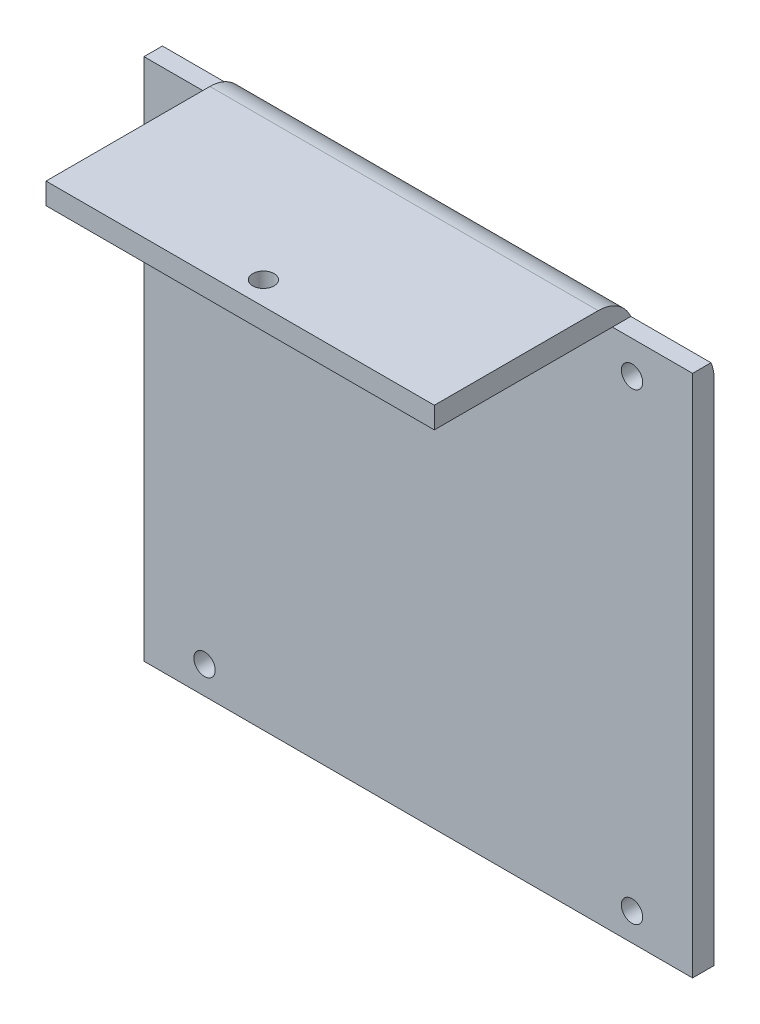
from build123d import *

# Parameters (mm, degrees)
ESQUISSE1_W             = 77
ESQUISSE1_H             = 73.5
ESQUISSE1_R             = 1.5
BOSS_EXTRU_1_DEPTH      = 3
ESQUISSE45_W            = 54.5
ESQUISSE45_H            = 3
BOSS_EXTRU_2_DEPTH      = 3
ESQUISSE46_W            = 54.5
ESQUISSE46_H            = 3
BOSS_EXTRU_3_DEPTH      = 25
CONG_1_R                = 5
ESQUISSE47_R            = 1.5
ENL_V_MAT_EXTRU_2_DEPTH = 25


with BuildPart() as part:
    # Esquisse1 → Boss.-Extru.1 (new body)
    with BuildSketch(Plane.XY):
        Rectangle(ESQUISSE1_W, ESQUISSE1_H)
        with Locations((30, 32.15)):
            Circle(ESQUISSE1_R, mode=Mode.SUBTRACT)
        with Locations((30, -32.85)):
            Circle(ESQUISSE1_R, mode=Mode.SUBTRACT)
        with Locations((-30, -32.85)):
            Circle(ESQUISSE1_R, mode=Mode.SUBTRACT)
        with Locations((-30, 32.15)):
            Circle(ESQUISSE1_R, mode=Mode.SUBTRACT)
    extrude(amount=BOSS_EXTRU_1_DEPTH)

    # Esquisse45 → Boss.-Extru.2 (add)
    with BuildSketch(Plane(origin=(0, 36.75, 0), x_dir=(1, 0, 0), z_dir=(0, 1, 0))):
        with Locations((0, -1.5)):
            Rectangle(ESQUISSE45_W, ESQUISSE45_H)
    extrude(amount=BOSS_EXTRU_2_DEPTH)

    # Esquisse46 → Boss.-Extru.3 (add)
    with BuildSketch(Plane.XY.offset(3)):
        with Locations((0, 38.25)):
            Rectangle(ESQUISSE46_W, ESQUISSE46_H)
    extrude(amount=BOSS_EXTRU_3_DEPTH)

    # Congé1
    cong_1_edges = [part.edges().sort_by_distance(p)[0] for p in [
        (0, 39.75, 0),
    ]]
    fillet(cong_1_edges, radius=CONG_1_R)

    # Esquisse47 → Enlèv. mat.-Extru.2 (cut)
    with BuildSketch(Plane(origin=(0, 39.75, 0), x_dir=(1, 0, 0), z_dir=(0, 1, 0))):
        with Locations(Location((0, -24.742583048, 0), (0, 0, 270))):
            Circle(ESQUISSE47_R)
    extrude(amount=-ENL_V_MAT_EXTRU_2_DEPTH, mode=Mode.SUBTRACT)


solid = part.part
